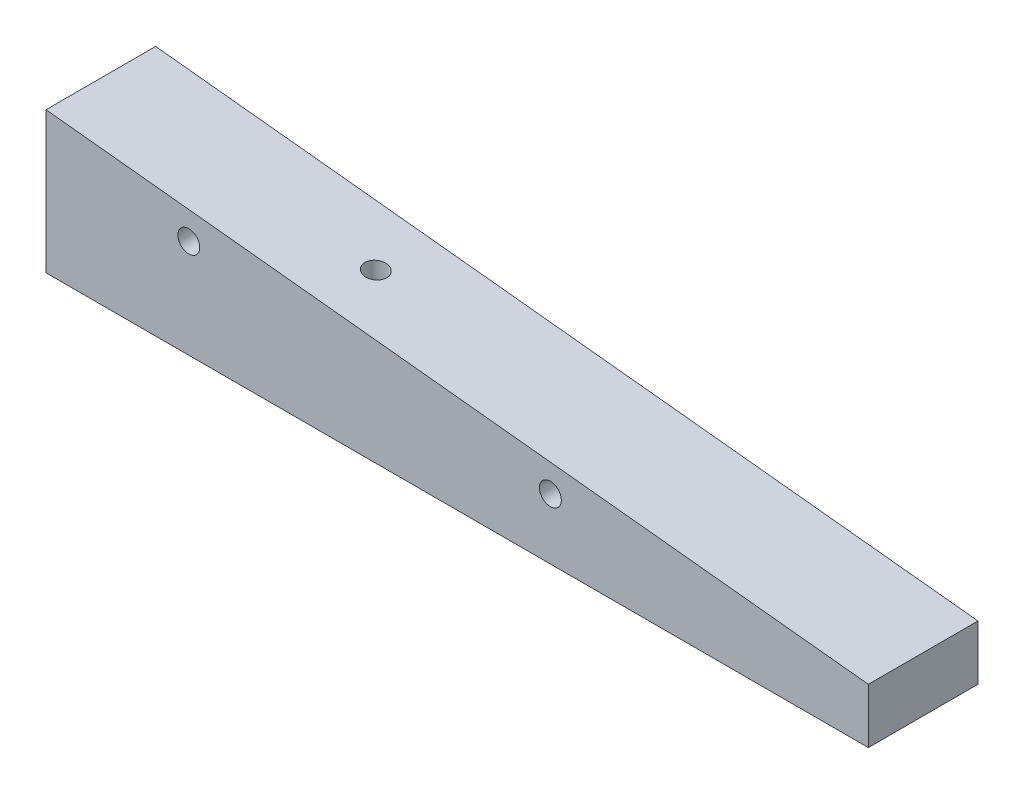
from build123d import *

# Parameters (mm, degrees)
BOSS_EXTRUDE1_DEPTH     = 10
CUT_EXTRUDE1_DEPTH      = 104.60672567
CUT_EXTRUDE1_DEPTH_BACK = 104.60672567
SKETCH2_R               = 2
CUT_EXTRUDE2_DEPTH      = 106.044531529
CUT_EXTRUDE2_DEPTH_BACK = 106.044531529
SKETCH3_R               = 2


with BuildPart() as part:
    # Sketch1 → Boss-Extrude1 (new, symmetric)
    with BuildSketch(Plane.XY):
        Polygon((99.852319163, 10), (-50.147680837, 25.76563529), (-50.147680837, 0), (99.852319163, 0), align=None)
    extrude(amount=BOSS_EXTRUDE1_DEPTH, both=True)

    # Sketch2 → Cut-Extrude1 (cut, two sides: drawn at the far end of the back side and taken through both)
    with BuildSketch(Plane.XZ.offset(-CUT_EXTRUDE1_DEPTH_BACK)):
        Circle(SKETCH2_R)
    extrude(amount=CUT_EXTRUDE1_DEPTH + CUT_EXTRUDE1_DEPTH_BACK, mode=Mode.SUBTRACT)

    # Sketch3 → Cut-Extrude2 (cut, two sides: drawn at the far end of the back side and taken through both)
    with BuildSketch(Plane(origin=(0, 0, -10), x_dir=(-1, 0, 0), z_dir=(0, 0, -1)).offset(-CUT_EXTRUDE2_DEPTH_BACK)):
        with Locations((24.103932874, 18.000785679)):
            Circle(SKETCH3_R)
        with Locations((-41.8489822, 11.068854977)):
            Circle(SKETCH3_R)
    extrude(amount=CUT_EXTRUDE2_DEPTH + CUT_EXTRUDE2_DEPTH_BACK, mode=Mode.SUBTRACT)


solid = part.part
